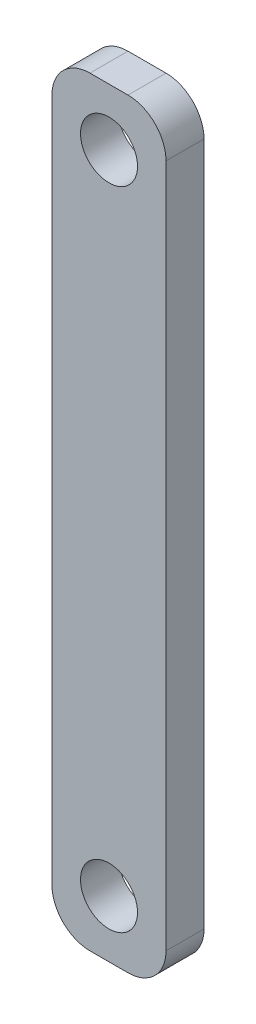
from build123d import *

# Parameters (mm, degrees)
ESQUISSE2_W        = 6
ESQUISSE2_H        = 40
ESQUISSE2_R        = 1.5
BOSS_EXTRU_2_DEPTH = 2
CONG_2_R           = 2


with BuildPart() as part:
    # Esquisse2 → Boss.-Extru.2 (new body)
    with BuildSketch(Plane.XY):
        Rectangle(ESQUISSE2_W, ESQUISSE2_H)
        with Locations((0, 17)):
            Circle(ESQUISSE2_R, mode=Mode.SUBTRACT)
        with Locations((0, -17)):
            Circle(ESQUISSE2_R, mode=Mode.SUBTRACT)
    extrude(amount=BOSS_EXTRU_2_DEPTH)

    # Congé2
    cong_2_edges = [part.edges().sort_by_distance(p)[0] for p in [
        (3, -20, 1),
        (-3, -20, 1),
        (-3, 20, 1),
        (3, 20, 1),
    ]]
    fillet(cong_2_edges, radius=CONG_2_R)


solid = part.part
